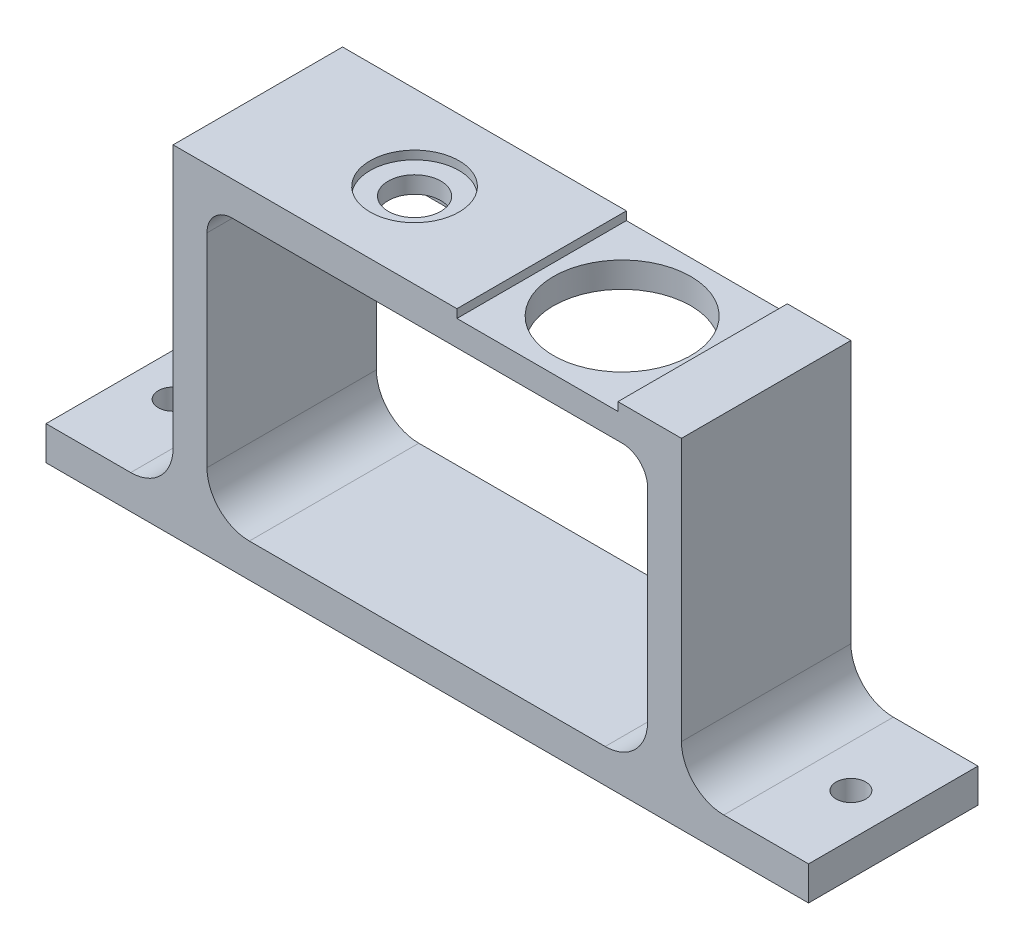
from build123d import *

# Parameters (mm, degrees)
SKETCH_1_W          = 90
SKETCH_1_H          = 20
SKETCH_1_R          = 1.75
EXTRUDE_1_DEPTH     = 4
SKETCH_2_W          = 4
SKETCH_2_H          = 20
EXTRUDE_2_DEPTH     = 32
SKETCH_3_W          = 60
SKETCH_3_H          = 20
SKETCH_3_R          = 8.1
EXTRUDE_3_DEPTH     = 4
FILLET_1_R          = 5
FILLET_2_R          = 3
SKETCH_4_W          = 19
SKETCH_4_H          = 20
CUT_EXTRUDE_1_DEPTH = 1
SKETCH_5_R          = 3.1
CUT_EXTRUDE_2_DEPTH = 10
SKETCH_6_W          = 13.6
SKETCH_6_H          = 7.5
CUT_EXTRUDE_3_DEPTH = 1
SKETCH_7_R          = 5.25
CUT_EXTRUDE_4_DEPTH = 1


with BuildPart() as part:
    # 草图1 → 凸台-拉伸1 (new body)
    with BuildSketch(Plane(origin=(0, 0, 0), x_dir=(1, 0, 0), z_dir=(0, 1, 0))):
        with Locations((45, 10)):
            Rectangle(SKETCH_1_W, SKETCH_1_H)
        with Locations(Location((85, 10, 0), (0, 0, 270))):
            Circle(SKETCH_1_R, mode=Mode.SUBTRACT)
        with Locations(Location((5, 10, 0), (0, 0, 90))):
            Circle(SKETCH_1_R, mode=Mode.SUBTRACT)
    extrude(amount=EXTRUDE_1_DEPTH)

    # 草图2 → 凸台-拉伸2 (add)
    with BuildSketch(Plane(origin=(0, 4, 0), x_dir=(1, 0, 0), z_dir=(0, 1, 0))):
        with Locations((17, 10)):
            Rectangle(SKETCH_2_W, SKETCH_2_H)
        with Locations((73, 10)):
            Rectangle(SKETCH_2_W, SKETCH_2_H)
    extrude(amount=EXTRUDE_2_DEPTH)

    # 草图3 → 凸台-拉伸3 (add)
    with BuildSketch(Plane(origin=(0, 36, 0), x_dir=(1, 0, 0), z_dir=(0, 1, 0))):
        with Locations((45, 10)):
            Rectangle(SKETCH_3_W, SKETCH_3_H)
        with Locations(Location((58, 10, 0), (0, 0, 270))):
            Circle(SKETCH_3_R, mode=Mode.SUBTRACT)
    extrude(amount=EXTRUDE_3_DEPTH)

    # 圆角1
    fillet_1_edges = [part.edges().sort_by_distance(p)[0] for p in [
        (15, 4, -10),
        (19, 4, -10),
        (75, 4, -10),
        (71, 4, -10),
    ]]
    fillet(fillet_1_edges, radius=FILLET_1_R)

    # 圆角2
    fillet_2_edges = [part.edges().sort_by_distance(p)[0] for p in [
        (19, 36, -10),
        (71, 36, -10),
    ]]
    fillet(fillet_2_edges, radius=FILLET_2_R)

    # 草图4 → 切除-拉伸1 (cut)
    with BuildSketch(Plane(origin=(0, 40, 0), x_dir=(1, 0, 0), z_dir=(0, 1, 0))):
        with Locations((58, 10)):
            Rectangle(SKETCH_4_W, SKETCH_4_H)
    extrude(amount=-CUT_EXTRUDE_1_DEPTH, mode=Mode.SUBTRACT)

    # 草图5 → 切除-拉伸2 (cut)
    with BuildSketch(Plane(origin=(0, 40, 0), x_dir=(1, 0, 0), z_dir=(0, 1, 0))):
        with Locations(Location((33.5, 10, 0), (0, 0, 270))):
            Circle(SKETCH_5_R)
    extrude(amount=-CUT_EXTRUDE_2_DEPTH, mode=Mode.SUBTRACT)

    # 草图6 → 切除-拉伸3 (cut)
    with BuildSketch(Plane.XZ.offset(-36)):
        with Locations((33.5, -10)):
            Rectangle(SKETCH_6_W, SKETCH_6_H)
    extrude(amount=-CUT_EXTRUDE_3_DEPTH, mode=Mode.SUBTRACT)

    # 草图7 → 切除-拉伸4 (cut)
    with BuildSketch(Plane(origin=(0, 40, 0), x_dir=(1, 0, 0), z_dir=(0, 1, 0))):
        with Locations(Location((33.5, 10, 0), (0, 0, 270))):
            Circle(SKETCH_7_R)
    extrude(amount=-CUT_EXTRUDE_4_DEPTH, mode=Mode.SUBTRACT)


solid = part.part
